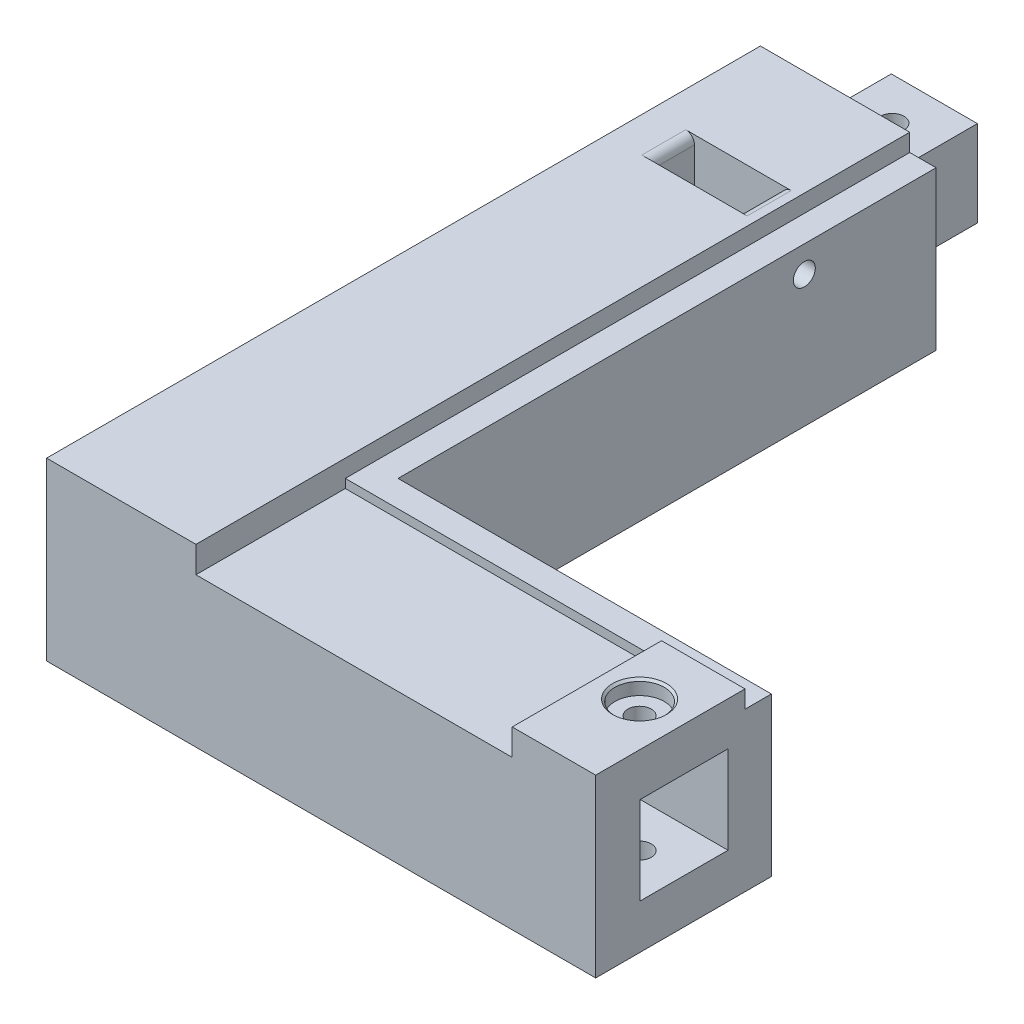
from build123d import *

# Parameters (mm, degrees)
BOSS_EXTRUDE1_DEPTH = 50.8
SKETCH3_W           = 25.4
SKETCH3_H           = 25.4
CUT_EXTRUDE1_DEPTH  = 25.4
SKETCH8_W           = 24.892
SKETCH8_H           = 24.892
BOSS_EXTRUDE2_DEPTH = 24.892
SKETCH12_R          = 3.429
CUT_EXTRUDE2_DEPTH  = 25.4
SKETCH13_W          = 25.4
SKETCH13_H          = 12.7
CUT_EXTRUDE3_DEPTH  = 25.908
FILLET1_R           = 2.54
SKETCH14_R          = 3.175
CUT_EXTRUDE5_DEPTH  = 246.663470197
CUT_EXTRUDE6_DEPTH  = 5.08
SKETCH18_W          = 91.44
SKETCH18_H          = 43.18
CUT_EXTRUDE7_DEPTH  = 7.62


with BuildPart() as part:
    # Sketch2 → Boss-Extrude1 (new body)
    with BuildSketch(Plane(origin=(0, 0, 0), x_dir=(1, 0, 0), z_dir=(0, 1, 0))):
        Polygon((-50.8, 155.575), (0, 155.575), (0, 0), (107.95, 0), (107.95, -50.8), (-50.8, -50.8), align=None)
    extrude(amount=BOSS_EXTRUDE1_DEPTH)

    # Sketch3 → Cut-Extrude1 (cut)
    with BuildSketch(Plane(origin=(107.95, 0, 0), x_dir=(0, 0, -1), z_dir=(1, 0, 0))):
        with Locations((-25.239912, 25.560088)):
            Rectangle(SKETCH3_W, SKETCH3_H)
    extrude(amount=-CUT_EXTRUDE1_DEPTH, mode=Mode.SUBTRACT)

    # Sketch7 → CBORE for 1/4 Binding Head Machine Screw1 (revolve, cut)
    with BuildSketch(Plane(origin=(95.25, 50.8, 25.4), x_dir=(0, 0, 1), z_dir=(1, 0, 0))):
        Polygon((0, 0), (0, 50.8), (3.3782, 50.8), (3.3782, 4.191), (7.14375, 4.191), (7.14375, 0.635), (7.77875, 0), align=None)
    revolve(axis=Axis((95.25, 57.15, 25.4), (0, -1, 0)), mode=Mode.SUBTRACT)

    # Sketch8 → Boss-Extrude2 (add)
    with BuildSketch(Plane(origin=(0, 0, -155.575), x_dir=(-1, 0, 0), z_dir=(0, 0, -1))):
        with Locations((25.4, 25.4)):
            Rectangle(SKETCH8_W, SKETCH8_H)
    extrude(amount=BOSS_EXTRUDE2_DEPTH)

    # Sketch12 → Cut-Extrude2 (cut)
    with BuildSketch(Plane(origin=(0, 37.846, 0), x_dir=(1, 0, 0), z_dir=(0, 1, 0))):
        with Locations(Location((-25.4, 168.275, 0), (0, 0, 270))):
            Circle(SKETCH12_R)
    extrude(amount=-CUT_EXTRUDE2_DEPTH, mode=Mode.SUBTRACT)

    # Sketch13 → Cut-Extrude3 (cut)
    with BuildSketch(Plane(origin=(0, 50.8, 0), x_dir=(1, 0, 0), z_dir=(0, 1, 0))):
        with Locations((-25.4, 117.475)):
            Rectangle(SKETCH13_W, SKETCH13_H)
    extrude(amount=-CUT_EXTRUDE3_DEPTH, mode=Mode.SUBTRACT)

    # Fillet1
    fillet1_edges = [part.edges().sort_by_distance(p)[0] for p in [
        (-38.1, 50.8, -117.475),
        (-12.7, 50.8, -117.475),
    ]]
    fillet(fillet1_edges, radius=FILLET1_R)

    # Sketch14 → Cut-Extrude5 (cut, through all)
    with BuildSketch(Plane.ZY.offset(50.8)):
        with Locations((-117.475, 38.1)):
            Circle(SKETCH14_R)
    extrude(amount=-CUT_EXTRUDE5_DEPTH, mode=Mode.SUBTRACT)

    # Sketch17 → Cut-Extrude6 (cut)
    with BuildSketch(Plane(origin=(0, 50.8, 0), x_dir=(1, 0, 0), z_dir=(0, 1, 0))):
        Polygon((0, 155.575), (0, 0), (107.95, 0), (107.95, -7.62), (-7.62, -7.62), (-7.62, 155.575), align=None)
    extrude(amount=-CUT_EXTRUDE6_DEPTH, mode=Mode.SUBTRACT)

    # Sketch18 → Cut-Extrude7 (cut)
    with BuildSketch(Plane(origin=(0, 50.8, 0), x_dir=(1, 0, 0), z_dir=(0, 1, 0))):
        with Locations((38.1, -29.21)):
            Rectangle(SKETCH18_W, SKETCH18_H)
    extrude(amount=-CUT_EXTRUDE7_DEPTH, mode=Mode.SUBTRACT)


solid = part.part
